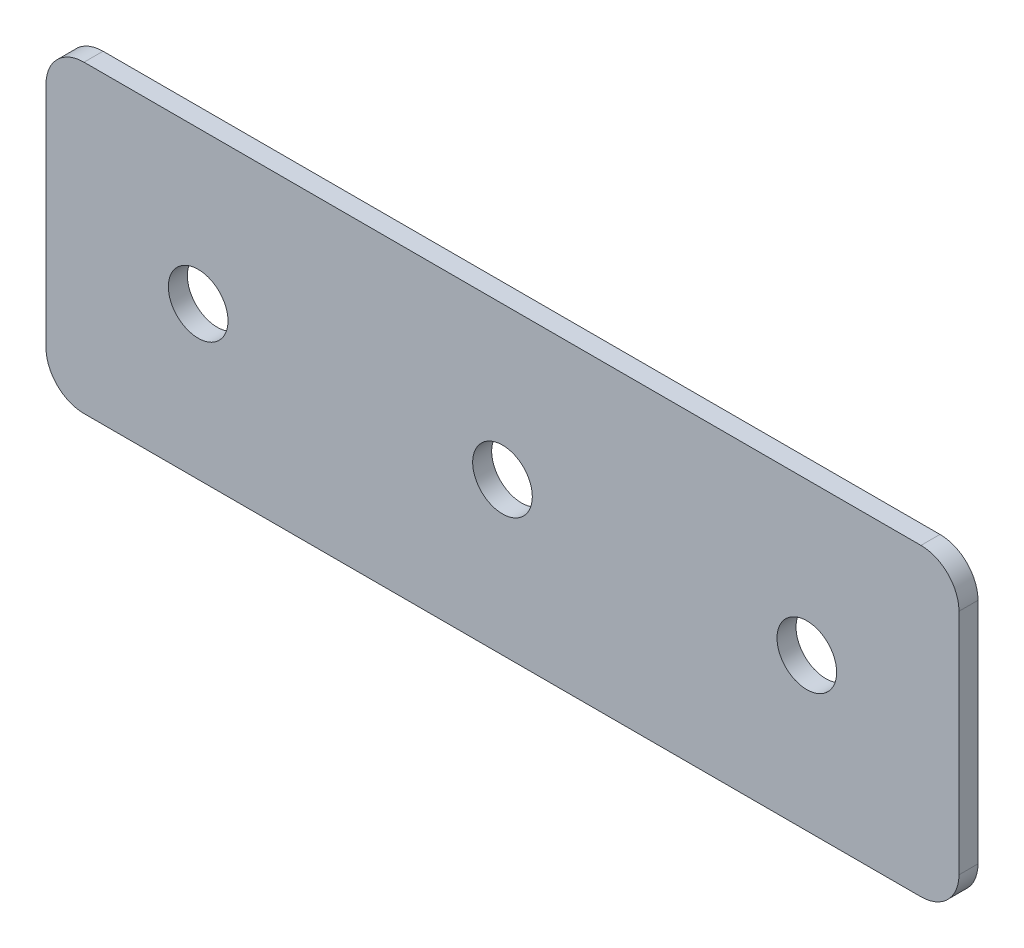
from build123d import *

# Parameters (mm, degrees)
SKETCH1_W           = 76.2
SKETCH1_H           = 25.4
BOSS_EXTRUDE1_DEPTH = 1.5875
SKETCH2_R           = 2.4892
CUT_EXTRUDE1_DEPTH  = 81.337538898
FILLET1_R           = 3.175


with BuildPart() as part:
    # Sketch1 → Boss-Extrude1 (new body)
    with BuildSketch(Plane.XY):
        with Locations((38.1, 12.7)):
            Rectangle(SKETCH1_W, SKETCH1_H)
    extrude(amount=-BOSS_EXTRUDE1_DEPTH)

    # Sketch2 → Cut-Extrude1 (cut, through all)
    with BuildSketch(Plane.XY):
        with Locations((12.7, 12.7)):
            Circle(SKETCH2_R)
        with Locations((38.1, 12.7)):
            Circle(SKETCH2_R)
        with Locations((63.5, 12.7)):
            Circle(SKETCH2_R)
        with Locations((88.9, 12.7)):
            Circle(SKETCH2_R)
        with Locations((114.3, 12.7)):
            Circle(SKETCH2_R)
    extrude(amount=-CUT_EXTRUDE1_DEPTH, mode=Mode.SUBTRACT)

    # Fillet1
    fillet1_edges = [part.edges().sort_by_distance(p)[0] for p in [
        (0, 25.4, -0.79375),
        (76.2, 25.4, -0.79375),
        (76.2, 0, -0.79375),
        (0, 0, -0.79375),
    ]]
    fillet(fillet1_edges, radius=FILLET1_R)


solid = part.part
